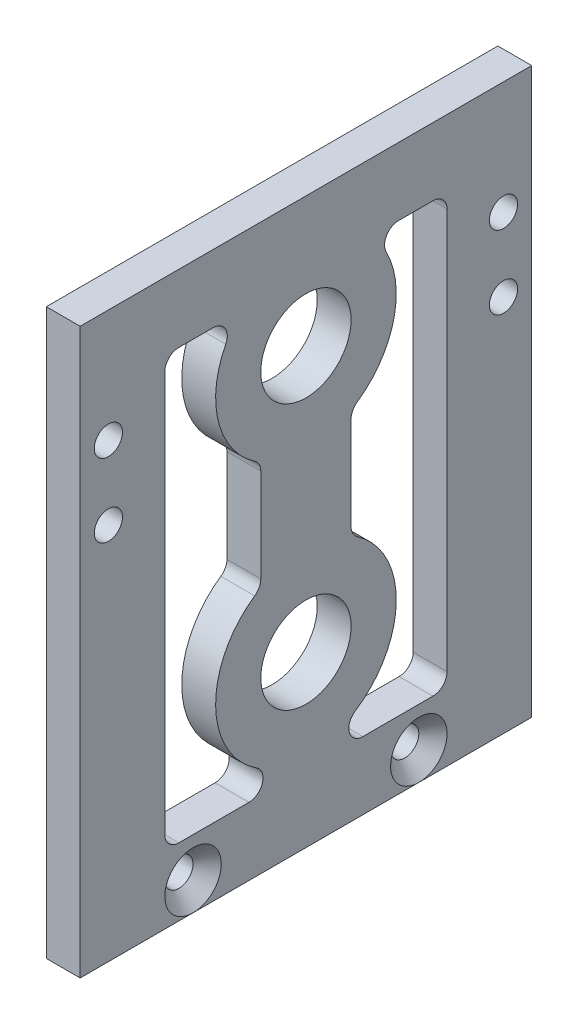
from build123d import *

# Parameters (mm, degrees)
ESQUISSE1_W      = 80
ESQUISSE1_H      = 100.00000000000001
EXTRUSION1_DEPTH = 6
ESQUISSE2_R      = 8
ESQUISSE2_R_2    = 7.999999999999998
ESQUISSE2_R_3    = 2.5000000000000018
ESQUISSE2_R_4    = 2.4999999999999956
ESQUISSE2_R_5    = 2.4999999999999982
ESQUISSE2_R_6    = 2.499999999999995
EXTRUSION3_DEPTH = 129.20296408429877
CHANFREIN1_SIZE  = 2.5


with BuildPart() as part:
    # Esquisse1 → Extrusion1 (new body)
    with BuildSketch(Plane(origin=(0, 0, 0), x_dir=(0, 0, -1), z_dir=(1, 0, 0))):
        with Locations((40, 50.00000000000001)):
            Rectangle(ESQUISSE1_W, ESQUISSE1_H)
    extrude(amount=EXTRUSION1_DEPTH)

    # Esquisse2 → Extrusion3 (cut, through all)
    with BuildSketch(Plane(origin=(6, 0, 0), x_dir=(0, 0, -1), z_dir=(1, 0, 0))):
        with Locations((40, 77.00000000000001)):
            Circle(ESQUISSE2_R)
        with Locations((40, 30)):
            Circle(ESQUISSE2_R_2)
        with Locations((5, 80)):
            Circle(ESQUISSE2_R_3)
        with Locations((75.00000000000001, 80)):
            Circle(ESQUISSE2_R_4)
        with Locations((5.000000000000136, 67)):
            Circle(ESQUISSE2_R_3)
        with Locations((75.00000000000016, 67)):
            Circle(ESQUISSE2_R_4)
        with Locations((20, 5.000000000000004)):
            Circle(ESQUISSE2_R_5)
        with Locations(Location((60.00000000000098, 5.000000000000004, 0), (0, 0, 180))):
            Circle(ESQUISSE2_R_6)
        with BuildLine():
            Line((17.499999999999996, 88.00000000000001), (23.568323274845017, 88.00000000000001))
            ThreePointArc((23.568323274845017, 88.00000000000001), (25.703928765288133, 86.79968811227509), (25.788820129595685, 84.35135135135135))
            ThreePointArc((25.788820129595685, 84.35135135135135), (24.477533819987812, 73.12017478610468), (30.918918918918916, 63.8267708439111))
            ThreePointArc((30.918918918918916, 63.8267708439111), (31.713289101913404, 62.930930175710394), (32, 61.7684537882722))
            Line((32, 61.7684537882722), (32, 45.231546211727824))
            ThreePointArc((32, 45.231546211727824), (31.713289101913414, 44.069069824289635), (30.918918918918926, 43.17322915608893))
            ThreePointArc((30.918918918918926, 43.17322915608893), (24.001358501680507, 29.79150489634176), (31.265293026281448, 16.594594594594593))
            ThreePointArc((31.265293026281448, 16.594594594594593), (32.297001527984975, 13.788131503185623), (29.900495061637923, 12))
            Line((29.900495061637923, 12), (17.500000000000007, 12))
            ThreePointArc((17.500000000000007, 12), (15.73223304703364, 12.732233047033631), (15.00000000000001, 14.499999999999998))
            Line((15.00000000000001, 14.499999999999998), (15.000000000000002, 85.5))
            ThreePointArc((15.000000000000002, 85.5), (15.732233047033617, 87.26776695296638), (17.499999999999996, 88.00000000000001))
        make_face()
        with BuildLine():
            Line((65, 85.5), (65.00000000000001, 14.5))
            ThreePointArc((65.00000000000001, 14.5), (64.26776695296637, 12.732233047033631), (62.5, 12))
            Line((62.5, 12), (50.09950493836208, 12))
            ThreePointArc((50.09950493836208, 12), (47.702998472015025, 13.78813150318562), (48.73470697371855, 16.594594594594593))
            ThreePointArc((48.73470697371855, 16.594594594594593), (55.99864149831949, 29.79150489634175), (49.08108108108109, 43.17322915608893))
            ThreePointArc((49.08108108108109, 43.17322915608893), (48.286710898086596, 44.06906982428963), (48, 45.23154621172782))
            Line((48, 45.23154621172782), (48, 61.7684537882722))
            ThreePointArc((48, 61.7684537882722), (48.286710898086596, 62.930930175710394), (49.08108108108109, 63.8267708439111))
            ThreePointArc((49.08108108108109, 63.8267708439111), (55.52246618001219, 73.1201747861047), (54.2111798704043, 84.35135135135137))
            ThreePointArc((54.2111798704043, 84.35135135135137), (54.29607123471186, 86.7996881122751), (56.43167672515498, 88.00000000000001))
            Line((56.43167672515498, 88.00000000000001), (62.5, 88.00000000000001))
            ThreePointArc((62.5, 88.00000000000001), (64.26776695296637, 87.26776695296637), (65, 85.5))
        make_face()
    extrude(amount=-EXTRUSION3_DEPTH, mode=Mode.SUBTRACT)

    # Chanfrein1
    chanfrein1_edges = [part.edges().sort_by_distance(p)[0] for p in [
        (6, 5.000000000000004, -17.5),
        (6, 5.0000000000000036, -62.50000000000097),
    ]]
    chamfer(chanfrein1_edges, length=CHANFREIN1_SIZE)


solid = part.part
